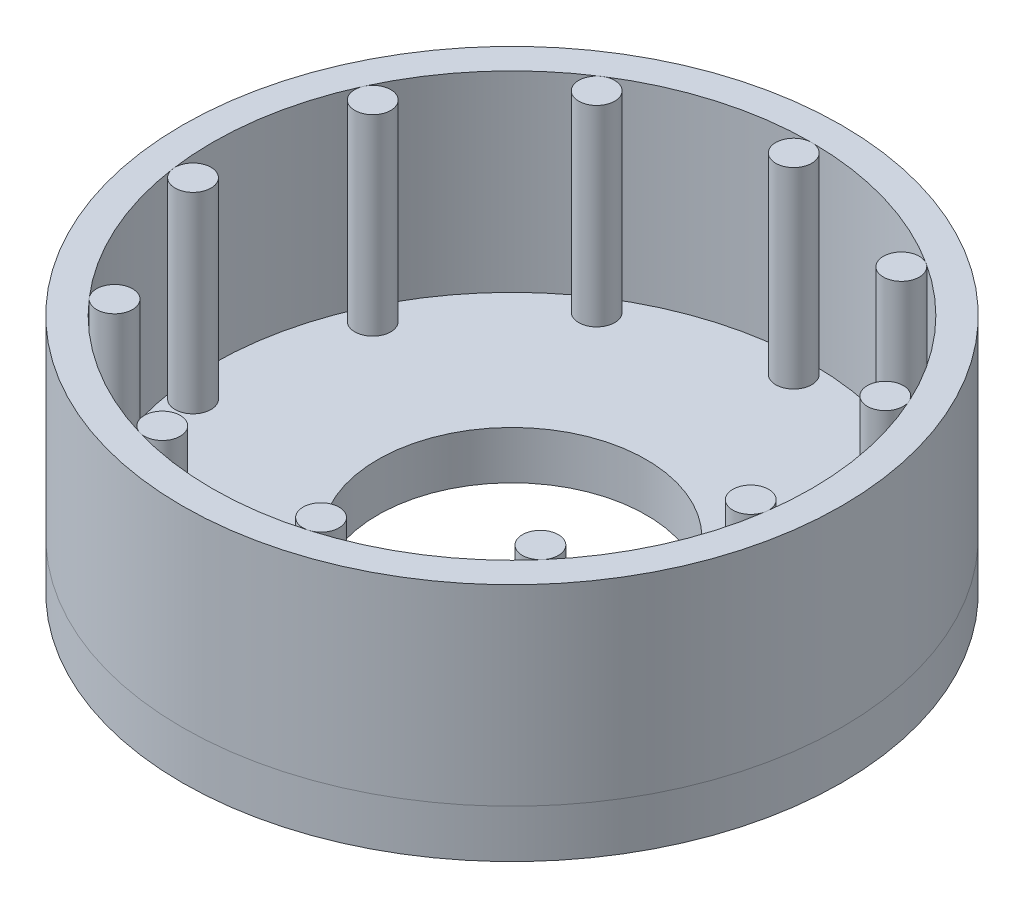
from build123d import *

# Parameters (mm, degrees)
SKETCH1_R               = 27.5
BOSS_EXTRUDE1_DEPTH     = 16
SKETCH1_R_2             = 1.5
BOSS_EXTRUDE1_2_DEPTH   = 16
BOSS_EXTRUDE1_3_DEPTH   = 16
BOSS_EXTRUDE1_4_DEPTH   = 16
BOSS_EXTRUDE1_5_DEPTH   = 16
BOSS_EXTRUDE1_6_DEPTH   = 16
BOSS_EXTRUDE1_7_DEPTH   = 16
BOSS_EXTRUDE1_8_DEPTH   = 16
BOSS_EXTRUDE1_9_DEPTH   = 16
BOSS_EXTRUDE1_10_DEPTH  = 16
BOSS_EXTRUDE1_11_DEPTH  = 16
BOSS_EXTRUDE1_12_DEPTH  = 16
BOSS_EXTRUDE2_START     = -4
SKETCH1_3_R             = 27.5
BOSS_EXTRUDE2_DEPTH     = 4
CUT_EXTRUDE1_DEPTH      = 43.053537307
CUT_EXTRUDE1_DEPTH_BACK = 43.053537307
SKETCH1_5_R             = 11.2


with BuildPart() as part:
    # Sketch1 → Boss-Extrude1 (new body)
    with BuildSketch(Plane(origin=(0, 0, 0), x_dir=(1, 0, 0), z_dir=(0, 1, 0))):
        Circle(SKETCH1_R)
        with BuildLine():
            ThreePointArc((-13.516020393, 21.031338349), (-7.0433139, 23.987324347), (-8e-09, 25))
            ThreePointArc((-8e-09, 25), (7.043313305, 23.987324521), (13.516019362, 21.031339011))
            ThreePointArc((13.516019362, 21.031339011), (18.893738404, 16.371519451), (22.740799203, 10.385376816))
            ThreePointArc((22.740799203, 10.385376816), (24.745535808, 3.557872623), (24.745536293, -3.557869248))
            ThreePointArc((24.745536293, -3.557869248), (22.74079993, -10.385375224), (18.893738373, -16.371519486))
            ThreePointArc((18.893738373, -16.371519486), (13.5160198, -21.03133873), (7.043313913, -23.987324343))
            ThreePointArc((7.043313913, -23.987324343), (-1.26e-07, -25), (-7.043314154, -23.987324272))
            ThreePointArc((-7.043314154, -23.987324272), (-13.516020537, -21.031338256), (-18.893739356, -16.371518352))
            ThreePointArc((-18.893739356, -16.371518352), (-22.740799882, -10.38537533), (-24.745536046, -3.557870964))
            ThreePointArc((-24.745536046, -3.557870964), (-24.74553605, 3.557870939), (-22.740799896, 10.385375298))
            ThreePointArc((-22.740799896, 10.385375298), (-18.893739352, 16.371518357), (-13.516020393, 21.031338349))
        make_face(mode=Mode.SUBTRACT)
    extrude(amount=BOSS_EXTRUDE1_DEPTH)


with BuildPart() as body_2:
    # Sketch1 → Boss-Extrude1 2 (new body)
    with BuildSketch(Plane(origin=(0, 0, 0), x_dir=(1, 0, 0), z_dir=(0, 1, 0))):
        with Locations((0, 23.5)):
            Circle(SKETCH1_R_2)
    extrude(amount=BOSS_EXTRUDE1_2_DEPTH)


with BuildPart() as body_3:
    # Sketch1 → Boss-Extrude1 3 (new body)
    with BuildSketch(Plane(origin=(0, 0, 0), x_dir=(1, 0, 0), z_dir=(0, 1, 0))):
        with Locations((-12.70505921, 19.769458022)):
            Circle(SKETCH1_R_2)
    extrude(amount=BOSS_EXTRUDE1_3_DEPTH)


with BuildPart() as body_4:
    # Sketch1 → Boss-Extrude1 4 (new body)
    with BuildSketch(Plane(origin=(0, 0, 0), x_dir=(1, 0, 0), z_dir=(0, 1, 0))):
        with Locations((-21.376351891, 9.762252806)):
            Circle(SKETCH1_R_2)
    extrude(amount=BOSS_EXTRUDE1_4_DEPTH)


with BuildPart() as body_5:
    # Sketch1 → Boss-Extrude1 5 (new body)
    with BuildSketch(Plane(origin=(0, 0, 0), x_dir=(1, 0, 0), z_dir=(0, 1, 0))):
        with Locations((-23.260803884, -3.344398699)):
            Circle(SKETCH1_R_2)
    extrude(amount=BOSS_EXTRUDE1_5_DEPTH)


with BuildPart() as body_6:
    # Sketch1 → Boss-Extrude1 6 (new body)
    with BuildSketch(Plane(origin=(0, 0, 0), x_dir=(1, 0, 0), z_dir=(0, 1, 0))):
        with Locations((-17.760114997, -15.389227248)):
            Circle(SKETCH1_R_2)
    extrude(amount=BOSS_EXTRUDE1_6_DEPTH)


with BuildPart() as body_7:
    # Sketch1 → Boss-Extrude1 7 (new body)
    with BuildSketch(Plane(origin=(0, 0, 0), x_dir=(1, 0, 0), z_dir=(0, 1, 0))):
        with Locations((-6.620715086, -22.54808488)):
            Circle(SKETCH1_R_2)
    extrude(amount=BOSS_EXTRUDE1_7_DEPTH)


with BuildPart() as body_8:
    # Sketch1 → Boss-Extrude1 8 (new body)
    with BuildSketch(Plane(origin=(0, 0, 0), x_dir=(1, 0, 0), z_dir=(0, 1, 0))):
        with Locations((6.620715086, -22.54808488)):
            Circle(SKETCH1_R_2)
    extrude(amount=BOSS_EXTRUDE1_8_DEPTH)


with BuildPart() as body_9:
    # Sketch1 → Boss-Extrude1 9 (new body)
    with BuildSketch(Plane(origin=(0, 0, 0), x_dir=(1, 0, 0), z_dir=(0, 1, 0))):
        with Locations((17.760114997, -15.389227248)):
            Circle(SKETCH1_R_2)
    extrude(amount=BOSS_EXTRUDE1_9_DEPTH)


with BuildPart() as body_10:
    # Sketch1 → Boss-Extrude1 10 (new body)
    with BuildSketch(Plane(origin=(0, 0, 0), x_dir=(1, 0, 0), z_dir=(0, 1, 0))):
        with Locations((23.260803884, -3.344398699)):
            Circle(SKETCH1_R_2)
    extrude(amount=BOSS_EXTRUDE1_10_DEPTH)


with BuildPart() as body_11:
    # Sketch1 → Boss-Extrude1 11 (new body)
    with BuildSketch(Plane(origin=(0, 0, 0), x_dir=(1, 0, 0), z_dir=(0, 1, 0))):
        with Locations((21.376351891, 9.762252806)):
            Circle(SKETCH1_R_2)
    extrude(amount=BOSS_EXTRUDE1_11_DEPTH)


with BuildPart() as body_12:
    # Sketch1 → Boss-Extrude1 12 (new body)
    with BuildSketch(Plane(origin=(0, 0, 0), x_dir=(1, 0, 0), z_dir=(0, 1, 0))):
        with Locations((12.70505921, 19.769458022)):
            Circle(SKETCH1_R_2)
    extrude(amount=BOSS_EXTRUDE1_12_DEPTH)


with BuildPart() as body_13:
    # Sketch1<3> → Boss-Extrude2 (new body)
    with BuildSketch(Plane(origin=(0, 0, 0), x_dir=(1, 0, 0), z_dir=(0, 1, 0)).offset(BOSS_EXTRUDE2_START)):
        Circle(SKETCH1_3_R)
    extrude(amount=BOSS_EXTRUDE2_DEPTH)

    # Sketch1<5> → Cut-Extrude1 (cut, two sides: drawn at the far end of the back side and taken through both)
    with BuildSketch(Plane(origin=(0, 0, 0), x_dir=(1, 0, 0), z_dir=(0, 1, 0)).offset(-CUT_EXTRUDE1_DEPTH_BACK)):
        Circle(SKETCH1_5_R)
    extrude(amount=CUT_EXTRUDE1_DEPTH + CUT_EXTRUDE1_DEPTH_BACK, mode=Mode.SUBTRACT)


solid = Compound([part.part, body_2.part, body_3.part, body_4.part, body_5.part, body_6.part, body_7.part, body_8.part, body_9.part, body_10.part, body_11.part, body_12.part, body_13.part])
